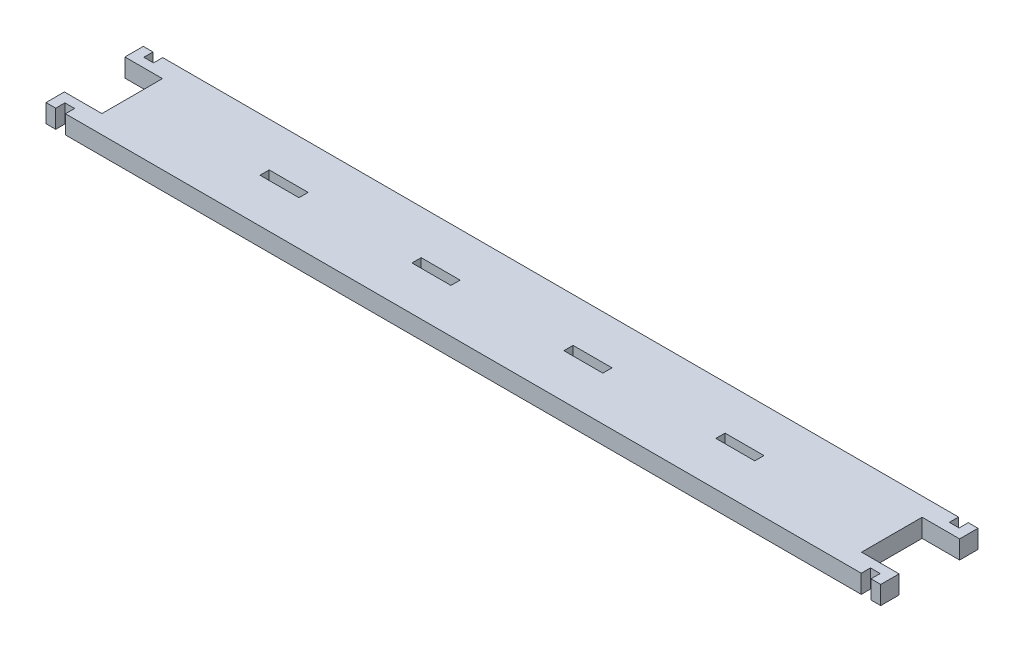
from build123d import *

# Parameters (mm, degrees)
SKETCH1_W                                = 247.904
SKETCH1_H                                = 31.75
BOSS_EXTRUDE1_DEPTH                      = 5.9944
BOSS_EXTRUDE3_DEPTH                      = 5.9944
MIRROR2_AT_THE_SECOND_PLANE_COPY_1_DEPTH = 5.9944
SKETCH3_W                                = 12.7
SKETCH3_H                                = 2.9972
CUT_EXTRUDE1_DEPTH                       = 138.247848812


with BuildPart() as part:
    # Sketch1 → Boss-Extrude1 (new body)
    with BuildSketch(Plane(origin=(0, 0, 0), x_dir=(1, 0, 0), z_dir=(0, 1, 0))):
        Rectangle(SKETCH1_W, SKETCH1_H)
    extrude(amount=BOSS_EXTRUDE1_DEPTH)

    # Sketch4 → Boss-Extrude3 (add)
    with BuildSketch(Plane(origin=(0, 5.9944, 0), x_dir=(1, 0, 0), z_dir=(0, 1, 0))):
        Polygon((-123.952, 9.8806), (-136.1948, 9.8806), (-136.1948, 15.875), (-133.0198, 15.875), (-133.0198, 12.8778), (-129.8448, 12.8778), (-129.8448, 15.875), (-123.952, 15.875), align=None)
    boss_extrude3 = extrude(amount=-BOSS_EXTRUDE3_DEPTH)

    # Mirror2: Boss-Extrude3 across plane
    add(boss_extrude3.mirror(Plane.XY))

    # Mirror2 at the second plane: Boss-Extrude3 across plane
    add(boss_extrude3.mirror(Plane(origin=(0, 0, 0), x_dir=(0, 0, 1), z_dir=(1, 0, 0))))

    # Mirror2 at the second plane copy 1 sketc → Mirror2 at the second plane copy 1 (add)
    with BuildSketch(Plane(origin=(0, 5.9944, 0), x_dir=(-1, 0, 0), z_dir=(0, 1, 0))):
        Polygon((-123.952, 9.8806), (-136.1948, 9.8806), (-136.1948, 15.875), (-133.0198, 15.875), (-133.0198, 12.8778), (-129.8448, 12.8778), (-129.8448, 15.875), (-123.952, 15.875), align=None)
    extrude(amount=-MIRROR2_AT_THE_SECOND_PLANE_COPY_1_DEPTH)

    # Sketch3 → Cut-Extrude1 (cut, through all)
    with BuildSketch(Plane(origin=(0, 5.9944, 0), x_dir=(1, 0, 0), z_dir=(0, 1, 0))):
        with Locations((-74.3712, 0)):
            Rectangle(SKETCH3_W, SKETCH3_H)
        with Locations((-24.7904, 0)):
            Rectangle(SKETCH3_W, SKETCH3_H)
        with Locations((24.7904, 0)):
            Rectangle(SKETCH3_W, SKETCH3_H)
        with Locations((74.3712, 0)):
            Rectangle(SKETCH3_W, SKETCH3_H)
    extrude(amount=-CUT_EXTRUDE1_DEPTH, mode=Mode.SUBTRACT)


solid = part.part
